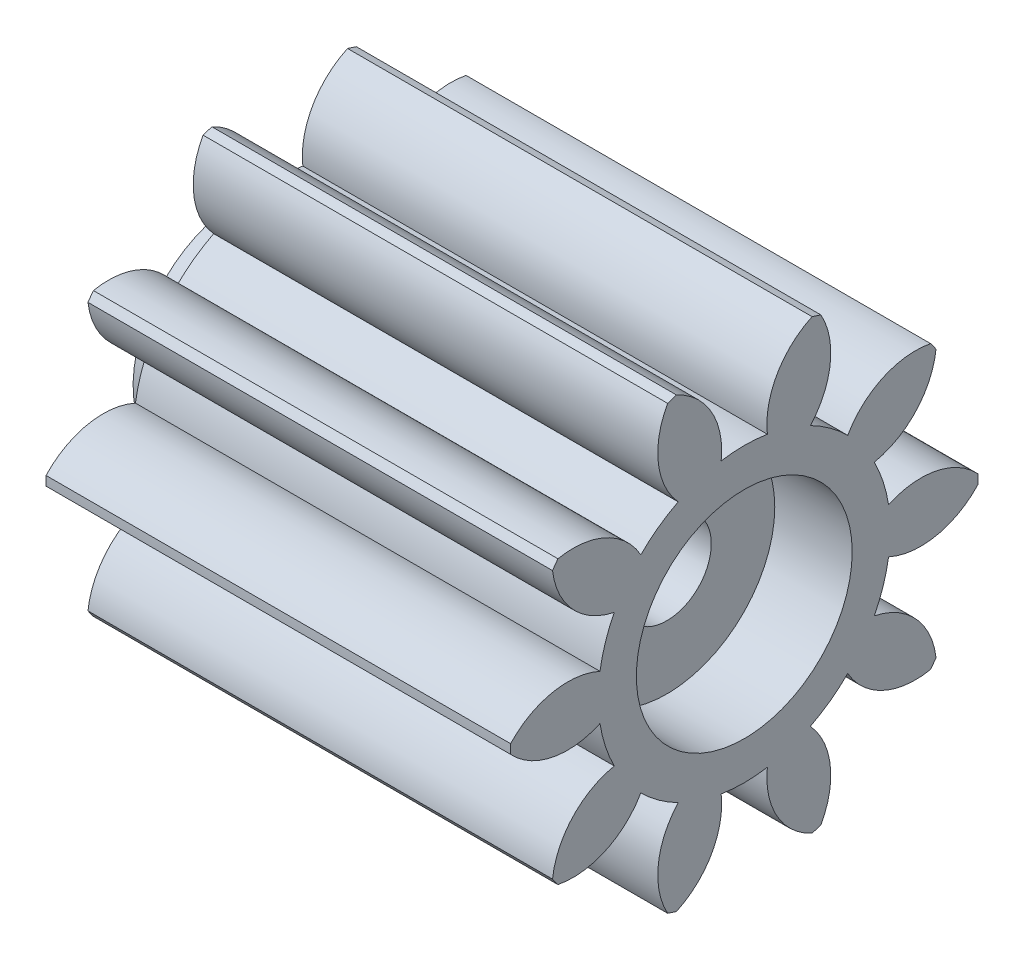
from build123d import *

# Parameters (mm, degrees)
SKETCH1_R                = 3.4
BOSS_EXTRUDE1_DEPTH      = 6
BOSS_EXTRUDE2_DEPTH      = 4
BOSS_EXTRUDE2_DEPTH_BACK = 7
SKETCH1_4_R              = 3.4
SKETCH1_4_R_2            = 1.4
SCALE1_SCALE_X           = 1
SCALE1_SCALE_Y           = 0.82
SCALE1_SCALE_Z           = 0.82


with BuildPart() as part:
    # Sketch1 → Boss-Extrude1 (new, symmetric)
    with BuildSketch(Plane(origin=(0, 0, 0), x_dir=(0, 0, -1), z_dir=(1, 0, 0))):
        with BuildLine():
            ThreePointArc((7.361576979, 0.145901498), (6.044874562, 0.88400656), (4.545240244, 0.711956427))
            ThreePointArc((4.545240244, 0.711956427), (4.375489574, 1.421682743), (4.095654089, 2.095640335))
            ThreePointArc((4.095654089, 2.095640335), (5.410012269, 2.837911789), (6.04139963, 4.208989591))
            ThreePointArc((6.04139963, 4.208989591), (5.956810471, 4.327876139), (5.869882133, 4.445063173))
            ThreePointArc((5.869882133, 4.445063173), (4.370800231, 4.26826445), (3.258699113, 3.247610033))
            ThreePointArc((3.258699113, 3.247610033), (2.704201274, 3.722013743), (2.081667278, 4.102773717))
            ThreePointArc((2.081667278, 4.102773717), (2.708709168, 5.475844293), (2.413612962, 6.956189714))
            ThreePointArc((2.413612962, 6.956189714), (2.275299135, 7.002650691), (2.136091822, 7.046361798))
            ThreePointArc((2.136091822, 7.046361798), (1.027228769, 6.022190393), (0.72744568, 4.542786988))
            ThreePointArc((0.72744568, 4.542786988), (0, 4.600661999), (-0.72744568, 4.542786988))
            ThreePointArc((-0.72744568, 4.542786988), (-1.027228769, 6.022190393), (-2.136091822, 7.046361798))
            ThreePointArc((-2.136091822, 7.046361798), (-2.275299135, 7.002650691), (-2.413612962, 6.956189714))
            ThreePointArc((-2.413612962, 6.956189714), (-2.708709168, 5.475844293), (-2.081667278, 4.102773717))
            ThreePointArc((-2.081667278, 4.102773717), (-2.704201274, 3.722013743), (-3.258699113, 3.247610033))
            ThreePointArc((-3.258699113, 3.247610033), (-4.370800231, 4.26826445), (-5.869882133, 4.445063173))
            ThreePointArc((-5.869882133, 4.445063173), (-5.956810471, 4.327876139), (-6.04139963, 4.208989591))
            ThreePointArc((-6.04139963, 4.208989591), (-5.410012269, 2.837911789), (-4.095654089, 2.095640335))
            ThreePointArc((-4.095654089, 2.095640335), (-4.375489574, 1.421682743), (-4.545240244, 0.711956427))
            ThreePointArc((-4.545240244, 0.711956427), (-6.044874562, 0.88400656), (-7.361576979, 0.145901498))
            ThreePointArc((-7.361576979, 0.145901498), (-7.363022672, 0), (-7.361576979, -0.145901498))
            ThreePointArc((-7.361576979, -0.145901498), (-6.044874562, -0.88400656), (-4.545240244, -0.711956427))
            ThreePointArc((-4.545240244, -0.711956427), (-4.375489574, -1.421682743), (-4.095654089, -2.095640335))
            ThreePointArc((-4.095654089, -2.095640335), (-5.410012269, -2.837911789), (-6.04139963, -4.208989591))
            ThreePointArc((-6.04139963, -4.208989591), (-5.956810471, -4.327876139), (-5.869882133, -4.445063173))
            ThreePointArc((-5.869882133, -4.445063173), (-4.370800231, -4.26826445), (-3.258699113, -3.247610033))
            ThreePointArc((-3.258699113, -3.247610033), (-2.704201274, -3.722013743), (-2.081667278, -4.102773717))
            ThreePointArc((-2.081667278, -4.102773717), (-2.708709168, -5.475844293), (-2.413612962, -6.956189714))
            ThreePointArc((-2.413612962, -6.956189714), (-2.275299135, -7.002650691), (-2.136091822, -7.046361798))
            ThreePointArc((-2.136091822, -7.046361798), (-1.027228769, -6.022190393), (-0.72744568, -4.542786988))
            ThreePointArc((-0.72744568, -4.542786988), (0, -4.600661999), (0.72744568, -4.542786988))
            ThreePointArc((0.72744568, -4.542786988), (1.027228769, -6.022190393), (2.136091822, -7.046361798))
            ThreePointArc((2.136091822, -7.046361798), (2.275299135, -7.002650691), (2.413612962, -6.956189714))
            ThreePointArc((2.413612962, -6.956189714), (2.708709168, -5.475844293), (2.081667278, -4.102773717))
            ThreePointArc((2.081667278, -4.102773717), (2.704201274, -3.722013743), (3.258699113, -3.247610033))
            ThreePointArc((3.258699113, -3.247610033), (4.370800231, -4.26826445), (5.869882133, -4.445063173))
            ThreePointArc((5.869882133, -4.445063173), (5.956810471, -4.327876139), (6.04139963, -4.208989591))
            ThreePointArc((6.04139963, -4.208989591), (5.410012269, -2.837911789), (4.095654089, -2.095640335))
            ThreePointArc((4.095654089, -2.095640335), (4.375489574, -1.421682743), (4.545240244, -0.711956427))
            ThreePointArc((4.545240244, -0.711956427), (6.044874562, -0.88400656), (7.361576979, -0.145901498))
            ThreePointArc((7.361576979, -0.145901498), (7.363022672, 0), (7.361576979, 0.145901498))
        make_face()
        Circle(SKETCH1_R, mode=Mode.SUBTRACT)
    extrude(amount=BOSS_EXTRUDE1_DEPTH, both=True)

    # Sketch1<4> → Boss-Extrude2 (add, two sides: drawn at the far end of the back side and taken through both)
    with BuildSketch(Plane(origin=(0, 0, 0), x_dir=(0, 0, -1), z_dir=(1, 0, 0)).offset(-BOSS_EXTRUDE2_DEPTH_BACK)):
        Circle(SKETCH1_4_R)
        Circle(SKETCH1_4_R_2, mode=Mode.SUBTRACT)
    extrude(amount=BOSS_EXTRUDE2_DEPTH + BOSS_EXTRUDE2_DEPTH_BACK)


with BuildPart() as part_1:
    # Scale1: scaled about (-0.416331804, 0, 0)
    add(part.part.scale((SCALE1_SCALE_X, SCALE1_SCALE_Y, SCALE1_SCALE_Z), about=(-0.416331804, 0, 0)))


solid = part_1.part
